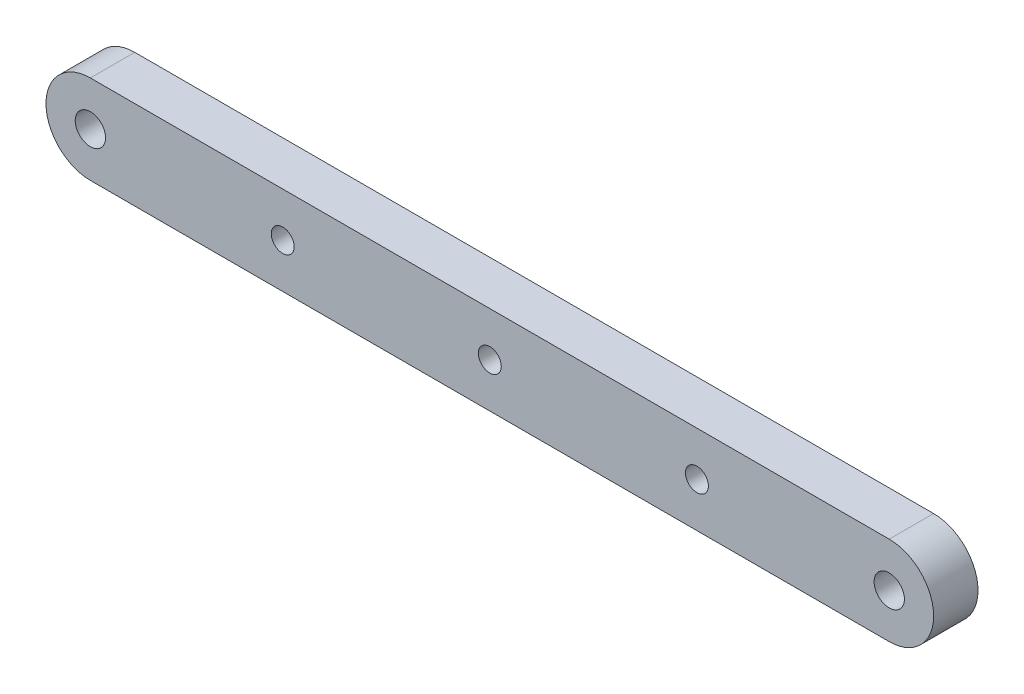
from build123d import *

# Parameters (mm, degrees)
DODANIE_WYCI_GNI_CIE1_DEPTH = 6
SZKIC2_R                    = 2.05
WYTNIJ_WYCI_GNI_CIE1_DEPTH  = 6
SZKIC3_R                    = 1.55
WYTNIJ_WYCI_GNI_CIE2_DEPTH  = 6


with BuildPart() as part:
    # Szkic1 → Dodanie-wyciągnięcie1 (new body)
    with BuildSketch(Plane.XY):
        with BuildLine():
            Line((135.201456632, 17.703969636), (27.201456632, 17.703969636))
            ThreePointArc((27.201456632, 17.703969636), (21.201456632, 11.703969636), (27.201456632, 5.703969636))
            Line((27.201456632, 5.703969636), (135.201456632, 5.703969636))
            ThreePointArc((135.201456632, 5.703969636), (141.201456632, 11.703969636), (135.201456632, 17.703969636))
        make_face()
    extrude(amount=DODANIE_WYCI_GNI_CIE1_DEPTH)

    # Szkic2 → Wytnij-wyciągnięcie1 (cut)
    with BuildSketch(Plane.XY.offset(6)):
        with Locations((135.201456632, 11.703969636)):
            Circle(SZKIC2_R)
        with Locations((27.201456632, 11.703969636)):
            Circle(SZKIC2_R)
    extrude(amount=-WYTNIJ_WYCI_GNI_CIE1_DEPTH, mode=Mode.SUBTRACT)

    # Szkic3 → Wytnij-wyciągnięcie2 (cut)
    with BuildSketch(Plane.XY.offset(6)):
        with Locations((53.201456632, 11.703969636)):
            Circle(SZKIC3_R)
        with Locations((81.201456632, 11.703969636)):
            Circle(SZKIC3_R)
        with Locations((109.201456632, 11.703969636)):
            Circle(SZKIC3_R)
    extrude(amount=-WYTNIJ_WYCI_GNI_CIE2_DEPTH, mode=Mode.SUBTRACT)


solid = part.part
